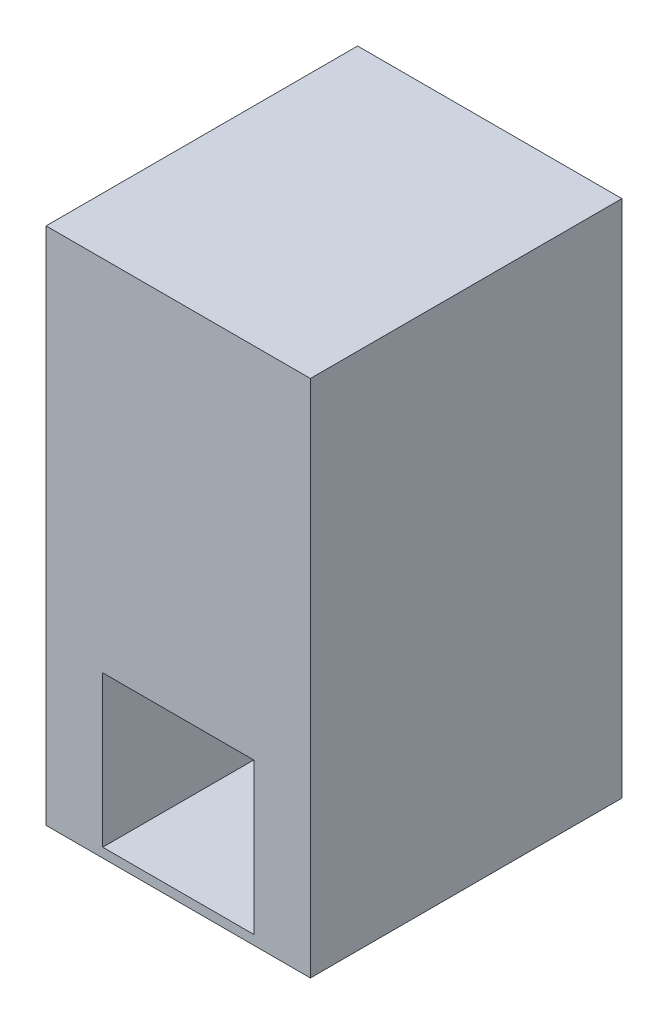
from build123d import *

# Parameters (mm, degrees)
SKETCH2_W           = 711.2
SKETCH2_H           = 838.2
BOSS_EXTRUDE1_DEPTH = 1397
SKETCH6_W           = 406.4
SKETCH6_H           = 406.4
CUT_EXTRUDE1_DEPTH  = 609.6


with BuildPart() as part:
    # Sketch2 → Boss-Extrude1 (new body)
    with BuildSketch(Plane(origin=(0, 0, 0), x_dir=(1, 0, 0), z_dir=(0, 1, 0))):
        Rectangle(SKETCH2_W, SKETCH2_H)
    extrude(amount=BOSS_EXTRUDE1_DEPTH)

    # Sketch6 → Cut-Extrude1 (cut)
    with BuildSketch(Plane.XY.offset(419.1)):
        with Locations((0, 228.6)):
            Rectangle(SKETCH6_W, SKETCH6_H)
    extrude(amount=-CUT_EXTRUDE1_DEPTH, mode=Mode.SUBTRACT)


solid = part.part
